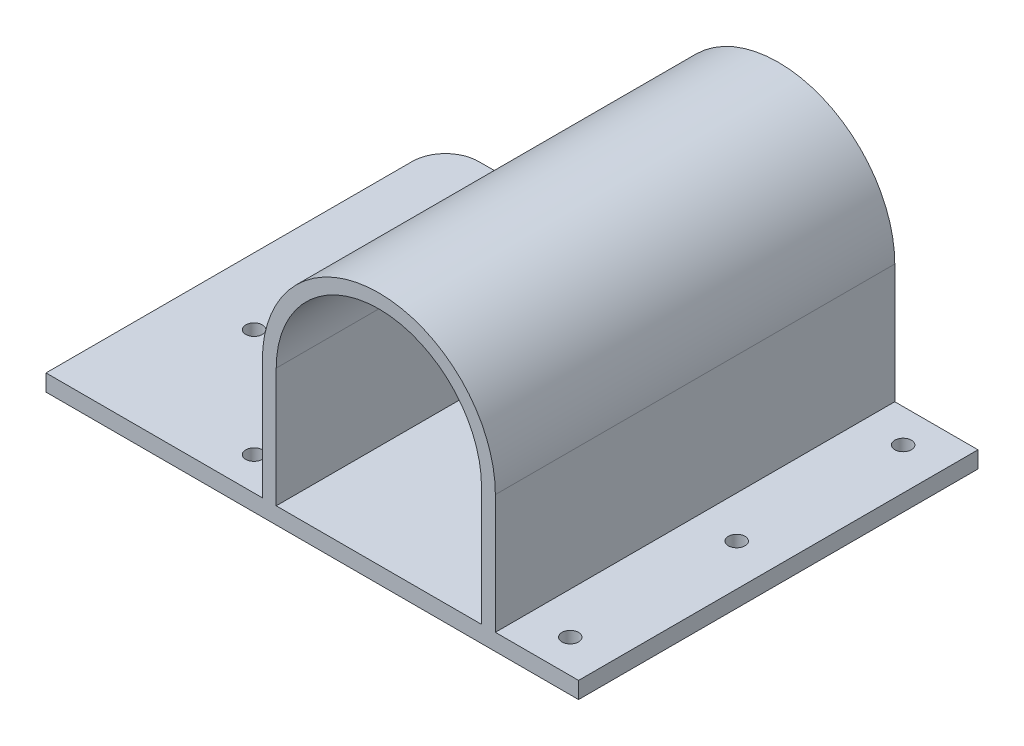
from build123d import *

# Parameters (mm, degrees)
SKETCH1_R           = 1.65
SKETCH1_R_2         = 6.15
BOSS_EXTRUDE1_DEPTH = 72
CUT_EXTRUDE1_DEPTH  = 57
SKETCH3_R           = 1.5
CUT_EXTRUDE2_DEPTH  = 92.028841583
SKETCH4_W           = 24
SKETCH4_H           = 72
SKETCH4_R           = 1.5
BOSS_EXTRUDE2_DEPTH = 3
FILLET1_R           = 6


with BuildPart() as part:
    # Sketch1 → Boss-Extrude1 (new body)
    with BuildSketch(Plane.XY):
        with BuildLine():
            Line((-21, 0), (-21, -21.5))
            Line((-21, -21.5), (-36, -21.5))
            Line((-36, -21.5), (-36, -24.5))
            Line((-36, -24.5), (36, -24.5))
            Line((36, -24.5), (36, -21.5))
            Line((36, -21.5), (21, -21.5))
            Line((21, -21.5), (21, 0))
            ThreePointArc((21, 0), (0, 21), (-21, 0))
        make_face()
        with Locations((0, -15.5)):
            Circle(SKETCH1_R, mode=Mode.SUBTRACT)
        with Locations((-13.423393759, -7.75)):
            Circle(SKETCH1_R, mode=Mode.SUBTRACT)
        with Locations((-13.423393759, 7.75)):
            Circle(SKETCH1_R, mode=Mode.SUBTRACT)
        with Locations((0, 15.5)):
            Circle(SKETCH1_R, mode=Mode.SUBTRACT)
        with Locations((13.423393759, 7.75)):
            Circle(SKETCH1_R, mode=Mode.SUBTRACT)
        with Locations((13.423393759, -7.75)):
            Circle(SKETCH1_R, mode=Mode.SUBTRACT)
        with Locations((-7, 0)):
            Circle(SKETCH1_R_2, mode=Mode.SUBTRACT)
    extrude(amount=BOSS_EXTRUDE1_DEPTH)

    # Sketch2 → Cut-Extrude1 (cut)
    with BuildSketch(Plane.XY.offset(72)):
        with BuildLine():
            Line((-18.5, 0), (-18.5, -21.5))
            Line((-18.5, -21.5), (18.5, -21.5))
            Line((18.5, -21.5), (18.5, 0))
            ThreePointArc((18.5, 0), (0, 18.5), (-18.5, 0))
        make_face()
    extrude(amount=-CUT_EXTRUDE1_DEPTH, mode=Mode.SUBTRACT)

    # Sketch3 → Cut-Extrude2 (cut, through all)
    with BuildSketch(Plane(origin=(0, -21.5, 0), x_dir=(1, 0, 0), z_dir=(0, 1, 0))):
        with Locations(Location((-28.5, -36, 0), (0, 0, 270))):
            Circle(SKETCH3_R)
        with Locations(Location((-28.5, -6, 0), (0, 0, 270))):
            Circle(SKETCH3_R)
        with Locations(Location((-28.5, -66, 0), (0, 0, 270))):
            Circle(SKETCH3_R)
        with Locations(Location((28.5, -66, 0), (0, 0, 90))):
            Circle(SKETCH3_R)
        with Locations(Location((28.5, -6, 0), (0, 0, 90))):
            Circle(SKETCH3_R)
        with Locations(Location((28.5, -36, 0), (0, 0, 90))):
            Circle(SKETCH3_R)
    extrude(amount=-CUT_EXTRUDE2_DEPTH, mode=Mode.SUBTRACT)

    # Sketch4 → Boss-Extrude2 (add)
    with BuildSketch(Plane(origin=(0, -21.5, 0), x_dir=(1, 0, 0), z_dir=(0, 1, 0))):
        with Locations((-48, -36)):
            Rectangle(SKETCH4_W, SKETCH4_H)
        with Locations(Location((-48, -46.5, 0), (0, 0, 270))):
            Circle(SKETCH4_R, mode=Mode.SUBTRACT)
        with Locations(Location((-48, -10.5, 0), (0, 0, 270))):
            Circle(SKETCH4_R, mode=Mode.SUBTRACT)
    extrude(amount=-BOSS_EXTRUDE2_DEPTH)

    # Fillet1
    fillet1_edges = [part.edges().sort_by_distance(p)[0] for p in [
        (-60, -23, 0),
    ]]
    fillet(fillet1_edges, radius=FILLET1_R)


solid = part.part
